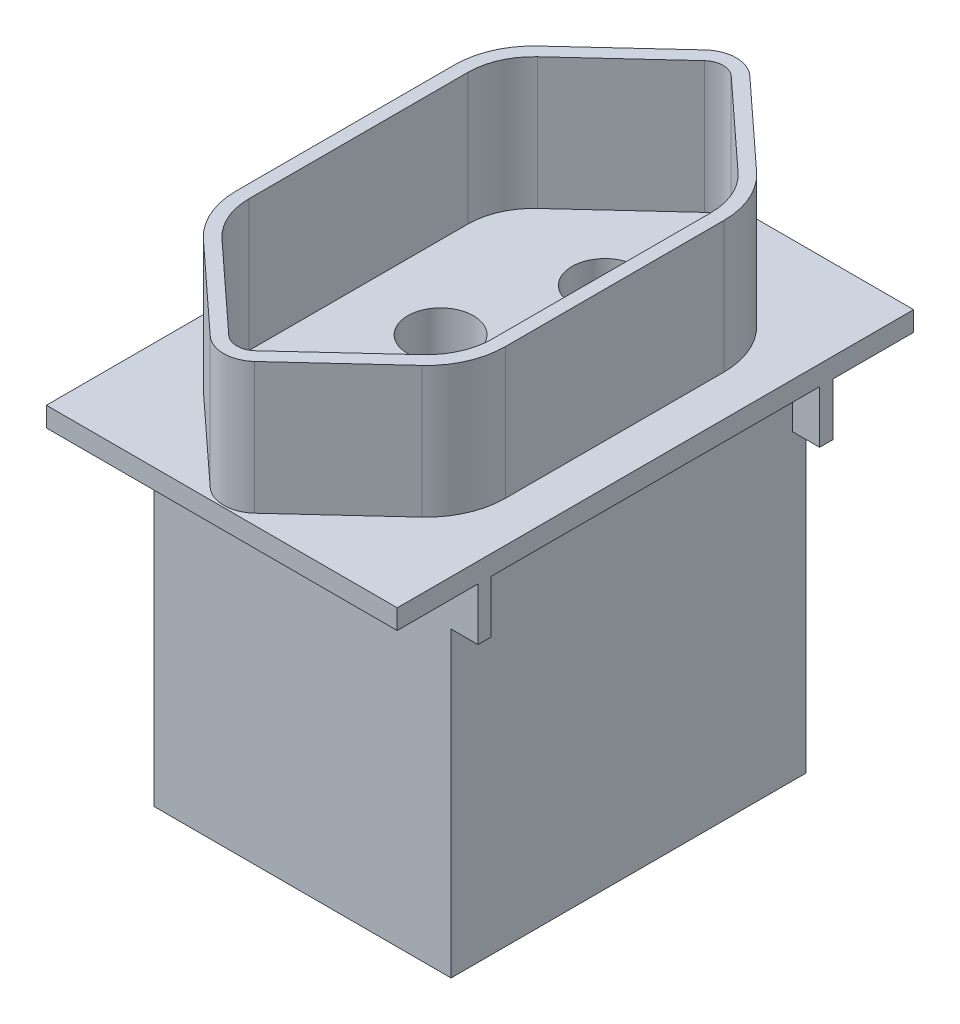
from build123d import *

# Parameters (mm, degrees)
ESBO_O1_W                = 26.7
ESBO_O1_H                = 39.3
RESSALTO_EXTRUS_O1_DEPTH = 38.5
CORTE_EXTRUS_O1_DEPTH    = 10
ESBO_O4_W                = 26.7
ESBO_O4_H                = 39.3
CORTE_EXTRUS_O2_DEPTH    = 10
ESBO_O5_W                = 26.7
ESBO_O5_H                = 39.3
ESBO_O5_W_2              = 22.6
ESBO_O5_H_2              = 27
CORTE_EXTRUS_O4_DEPTH    = 27
ESBO_O6_R                = 2.5
CORTE_EXTRUS_O5_DEPTH    = 5
ESBO_O7_W                = 2.05
ESBO_O7_H                = 1
RESSALTO_EXTRUS_O2_DEPTH = 4


with BuildPart() as part:
    # Esboço1 → Ressalto-extrusão1 (new body)
    with BuildSketch(Plane(origin=(0, 0, 0), x_dir=(1, 0, 0), z_dir=(0, 1, 0))):
        Rectangle(ESBO_O1_W, ESBO_O1_H)
    extrude(amount=-RESSALTO_EXTRUS_O1_DEPTH)

    # Esboço2 → Corte-extrusão1 (cut)
    with BuildSketch(Plane(origin=(0, 0, 0), x_dir=(1, 0, 0), z_dir=(0, 1, 0))):
        with BuildLine():
            Line((1.016622231, -18.102941176), (7.638740771, -11.999086257))
            ThreePointArc((7.638740771, -11.999086257), (8.829503459, -10.32964035), (9.25, -8.322615669))
            Line((9.25, -8.322615669), (9.25, 8.322615669))
            ThreePointArc((9.25, 8.322615669), (8.829503459, 10.32964035), (7.638740771, 11.999086257))
            Line((7.638740771, 11.999086257), (1.016622231, 18.102941176))
            ThreePointArc((1.016622231, 18.102941176), (0, 18.5), (-1.016622231, 18.102941176))
            Line((-1.016622231, 18.102941176), (-7.638740771, 11.999086257))
            ThreePointArc((-7.638740771, 11.999086257), (-8.829503459, 10.32964035), (-9.25, 8.322615669))
            Line((-9.25, 8.322615669), (-9.25, -8.322615669))
            ThreePointArc((-9.25, -8.322615669), (-8.829503459, -10.32964035), (-7.638740771, -11.999086257))
            Line((-7.638740771, -11.999086257), (-1.016622231, -18.102941176))
            ThreePointArc((-1.016622231, -18.102941176), (0, -18.5), (1.016622231, -18.102941176))
        make_face()
    extrude(amount=-CORTE_EXTRUS_O1_DEPTH, mode=Mode.SUBTRACT)

    # Esboço4 → Corte-extrusão2 (cut)
    with BuildSketch(Plane(origin=(0, 0, 0), x_dir=(1, 0, 0), z_dir=(0, 1, 0))):
        Rectangle(ESBO_O4_W, ESBO_O4_H)
        with BuildLine():
            ThreePointArc((-8.316488925, 12.734380374), (-9.74540415, 10.731045286), (-10.25, 8.322615669))
            Line((-10.25, 8.322615669), (-10.25, -8.322615669))
            ThreePointArc((-10.25, -8.322615669), (-9.74540415, -10.731045286), (-8.316488925, -12.734380374))
            Line((-8.316488925, -12.734380374), (-1.694370386, -18.838235294))
            ThreePointArc((-1.694370386, -18.838235294), (0, -19.5), (1.694370386, -18.838235294))
            Line((1.694370386, -18.838235294), (8.316488925, -12.734380374))
            ThreePointArc((8.316488925, -12.734380374), (9.74540415, -10.731045286), (10.25, -8.322615669))
            Line((10.25, -8.322615669), (10.25, 8.322615669))
            ThreePointArc((10.25, 8.322615669), (9.74540415, 10.731045286), (8.316488925, 12.734380374))
            Line((8.316488925, 12.734380374), (1.694370386, 18.838235294))
            ThreePointArc((1.694370386, 18.838235294), (0, 19.5), (-1.694370386, 18.838235294))
            Line((-1.694370386, 18.838235294), (-8.316488925, 12.734380374))
        make_face(mode=Mode.SUBTRACT)
    extrude(amount=-CORTE_EXTRUS_O2_DEPTH, mode=Mode.SUBTRACT)

    # Esboço5 → Corte-extrusão4 (cut)
    with BuildSketch(Plane.XZ.offset(38.5)):
        Rectangle(ESBO_O5_W, ESBO_O5_H)
        Rectangle(ESBO_O5_W_2, ESBO_O5_H_2, mode=Mode.SUBTRACT)
    extrude(amount=-CORTE_EXTRUS_O4_DEPTH, mode=Mode.SUBTRACT)

    # Esboço6 → Corte-extrusão5 (cut)
    with BuildSketch(Plane(origin=(0, -10, 0), x_dir=(1, 0, 0), z_dir=(0, 1, 0))):
        with Locations(Location((0, -9.5, 0), (0, 0, 270))):
            Circle(ESBO_O6_R)
        with Locations(Location((0, 9.5, 0), (0, 0, 270))):
            Circle(ESBO_O6_R)
        with Locations(Location((-3, 0, 0), (0, 0, 270))):
            Circle(ESBO_O6_R)
    extrude(amount=-CORTE_EXTRUS_O5_DEPTH, mode=Mode.SUBTRACT)

    # Esboço7 → Ressalto-extrusão2 (add)
    with BuildSketch(Plane.XZ.offset(11.5)):
        with Locations((12.325, 13)):
            Rectangle(ESBO_O7_W, ESBO_O7_H)
        with Locations((-12.325, 13)):
            Rectangle(ESBO_O7_W, ESBO_O7_H)
        with Locations((-12.325, -13)):
            Rectangle(ESBO_O7_W, ESBO_O7_H)
        with Locations((12.325, -13)):
            Rectangle(ESBO_O7_W, ESBO_O7_H)
    extrude(amount=RESSALTO_EXTRUS_O2_DEPTH)


solid = part.part
